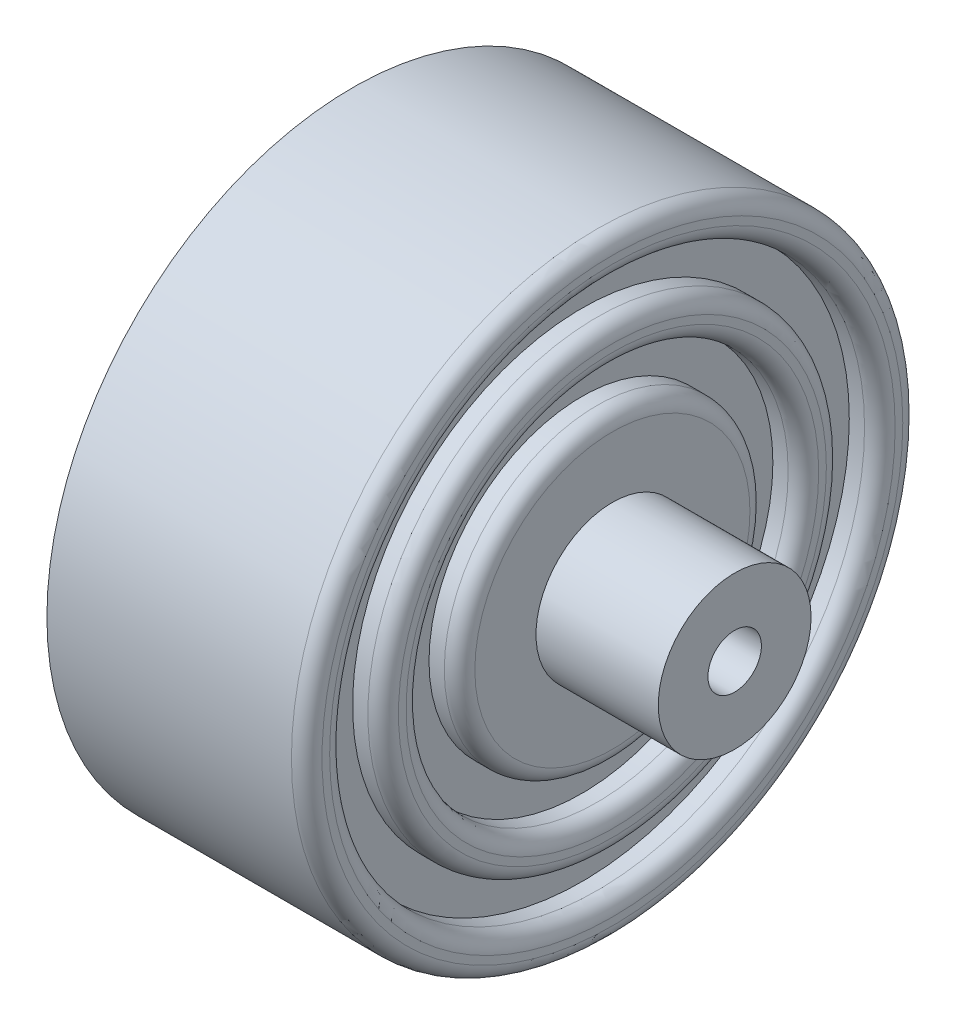
from build123d import *

# Parameters (mm, degrees)
SKETCH1_R           = 20
BOSS_EXTRUDE1_DEPTH = 26
CUT_EXTRUDE1_START  = -9
SKETCH3_R           = 20
SKETCH3_R_2         = 5
CUT_EXTRUDE1_DEPTH  = 9
SKETCH4_R           = 1.75
CUT_EXTRUDE2_DEPTH  = 15
CUT_EXTRUDE4_DEPTH  = 2
SKETCH8_R           = 1.5
CUT_EXTRUDE5_DEPTH  = 38.094473982
CUT_EXTRUDE6_START  = -2
SKETCH9_R           = 17.5
SKETCH9_R_2         = 15
SKETCH9_R_3         = 12.5
SKETCH9_R_4         = 10
CUT_EXTRUDE6_DEPTH  = 2
FILLET1_R           = 1
FILLET2_R           = 1
FILLET3_R           = 1
FILLET4_R           = 1
FILLET5_R           = 1
CUT_EXTRUDE7_START  = -1
SKETCH10_R          = 5
CUT_EXTRUDE7_DEPTH  = 1


with BuildPart() as part:
    # Sketch1 → Boss-Extrude1 (new body)
    with BuildSketch(Plane(origin=(0, 0, 0), x_dir=(0, 0, -1), z_dir=(1, 0, 0))):
        with Locations(Location((0, 0, 0), (0, 0, 180))):
            Circle(SKETCH1_R)
    extrude(amount=BOSS_EXTRUDE1_DEPTH)

    # Sketch3 → Cut-Extrude1 (cut)
    with BuildSketch(Plane(origin=(26, 0, 0), x_dir=(0, 0, -1), z_dir=(1, 0, 0)).offset(CUT_EXTRUDE1_START)):
        with Locations(Location((0, 0, 0), (0, 0, 180))):
            Circle(SKETCH3_R)
        Circle(SKETCH3_R_2, mode=Mode.SUBTRACT)
    extrude(amount=CUT_EXTRUDE1_DEPTH, mode=Mode.SUBTRACT)

    # Sketch4 → Cut-Extrude2 (cut)
    with BuildSketch(Plane(origin=(26, 0, 0), x_dir=(0, 0, -1), z_dir=(1, 0, 0))):
        Circle(SKETCH4_R)
    extrude(amount=-CUT_EXTRUDE2_DEPTH, mode=Mode.SUBTRACT)

    # Sketch7 → Cut-Extrude4 (cut)
    with BuildSketch(Plane.ZY):
        with BuildLine():
            Line((-18, 1.5), (-8.518780875, 5.237401303))
            ThreePointArc((-8.518780875, 5.237401303), (-7.147984075, 6.993305632), (-5.422484014, 8.402182283))
            Line((-5.422484014, 8.402182283), (-1.5, 18))
            ThreePointArc((-1.5, 18), (0, 19.5), (1.5, 18))
            Line((1.5, 18), (5.422484014, 8.402182283))
            ThreePointArc((5.422484014, 8.402182283), (7.147984075, 6.993305632), (8.518780875, 5.237401303))
            Line((8.518780875, 5.237401303), (18, 1.5))
            ThreePointArc((18, 1.5), (19.5, 0), (18, -1.5))
            Line((18, -1.5), (8.518780875, -5.237401303))
            ThreePointArc((8.518780875, -5.237401303), (7.147984075, -6.993305632), (5.422484014, -8.402182283))
            Line((5.422484014, -8.402182283), (1.5, -18))
            ThreePointArc((1.5, -18), (0, -19.5), (-1.5, -18))
            Line((-1.5, -18), (-5.422484014, -8.402182283))
            ThreePointArc((-5.422484014, -8.402182283), (-7.147984075, -6.993305632), (-8.518780875, -5.237401303))
            Line((-8.518780875, -5.237401303), (-18, -1.5))
            ThreePointArc((-18, -1.5), (-19.5, 0), (-18, 1.5))
        make_face()
    extrude(amount=-CUT_EXTRUDE4_DEPTH, mode=Mode.SUBTRACT)

    # Sketch8 → Cut-Extrude5 (cut, through all)
    with BuildSketch(Plane.ZY.offset(-2)):
        Circle(SKETCH8_R)
    extrude(amount=-CUT_EXTRUDE5_DEPTH, mode=Mode.SUBTRACT)

    # Sketch9 → Cut-Extrude6 (cut)
    # profile 1 of 2: a face of its own
    with BuildSketch(Plane(origin=(17, 0, 0), x_dir=(0, 0, -1), z_dir=(1, 0, 0)).offset(CUT_EXTRUDE6_START)):
        Circle(SKETCH9_R)
        Circle(SKETCH9_R_2, mode=Mode.SUBTRACT)
    # profile 2 of 2: a face of its own
    with BuildSketch(Plane(origin=(17, 0, 0), x_dir=(0, 0, -1), z_dir=(1, 0, 0)).offset(CUT_EXTRUDE6_START)):
        Circle(SKETCH9_R_3)
        Circle(SKETCH9_R_4, mode=Mode.SUBTRACT)
    extrude(amount=CUT_EXTRUDE6_DEPTH, mode=Mode.SUBTRACT)

    # Fillet1
    fillet1_edges = [part.edges().sort_by_distance(p)[0] for p in [
        (17, 0, 17.5),
    ]]
    fillet(fillet1_edges, radius=FILLET1_R)

    # Fillet2
    fillet2_edges = [part.edges().sort_by_distance(p)[0] for p in [
        (17, 0, -20),
    ]]
    fillet(fillet2_edges, radius=FILLET2_R)

    # Fillet3
    fillet3_edges = [part.edges().sort_by_distance(p)[0] for p in [
        (17, 0, 15),
    ]]
    fillet(fillet3_edges, radius=FILLET3_R)

    # Fillet4
    fillet4_edges = [part.edges().sort_by_distance(p)[0] for p in [
        (17, 0, 12.5),
    ]]
    fillet(fillet4_edges, radius=FILLET4_R)

    # Fillet5
    fillet5_edges = [part.edges().sort_by_distance(p)[0] for p in [
        (17, 0, 10),
    ]]
    fillet(fillet5_edges, radius=FILLET5_R)

    # Sketch10 → Cut-Extrude7 (cut)
    with BuildSketch(Plane(origin=(26, 0, 0), x_dir=(0, 0, -1), z_dir=(1, 0, 0)).offset(CUT_EXTRUDE7_START)):
        Circle(SKETCH10_R)
    extrude(amount=CUT_EXTRUDE7_DEPTH, mode=Mode.SUBTRACT)


solid = part.part
